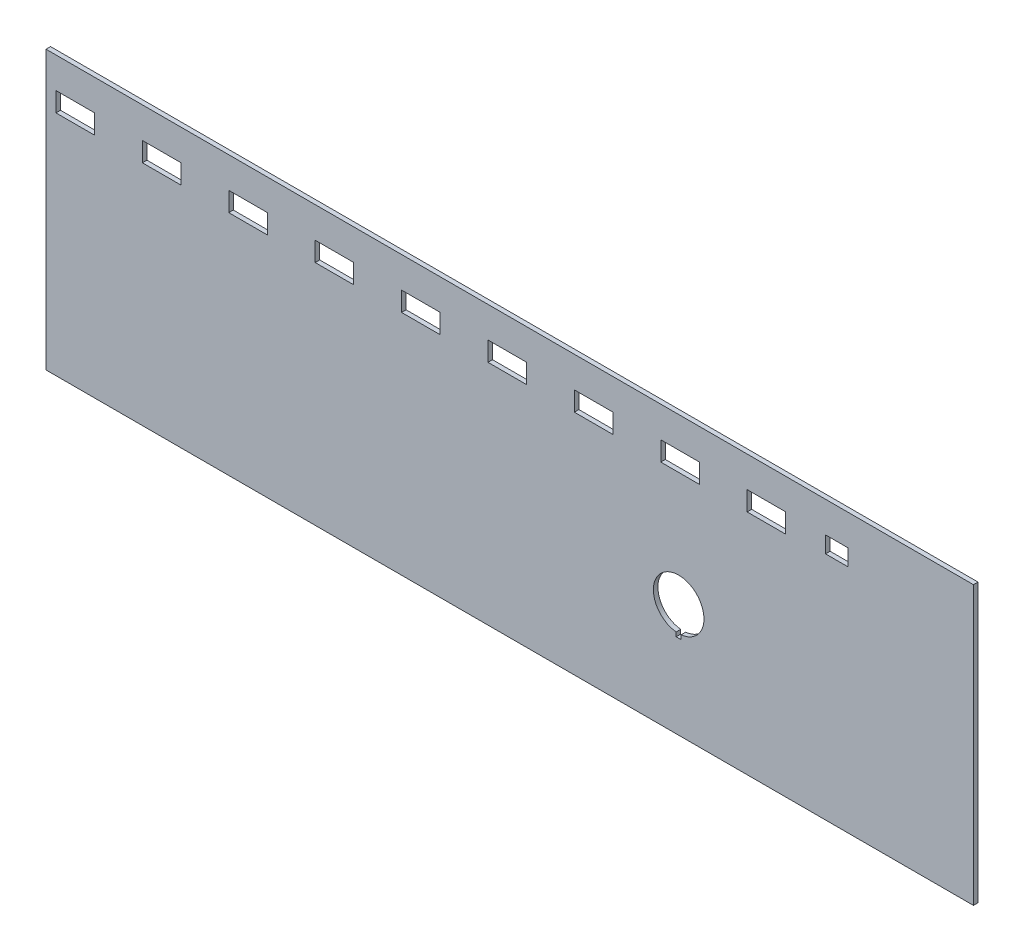
from build123d import *

# Parameters (mm, degrees)
SKETCH1_W               = 409
SKETCH1_H               = 122.5
BOSS_EXTRUDE1_DEPTH     = 2
CUT_EXTRUDE2_DEPTH      = 427.955793965
CUT_EXTRUDE2_DEPTH_BACK = 427.955793965
SKETCH2_W               = 17
SKETCH2_H               = 8.53
SKETCH2_W_2             = 10
SKETCH2_H_2             = 7.25


with BuildPart() as part:
    # Sketch1 → Boss-Extrude1 (new body)
    with BuildSketch(Plane.XY):
        with Locations((204.5, -61.25)):
            Rectangle(SKETCH1_W, SKETCH1_H)
    extrude(amount=BOSS_EXTRUDE1_DEPTH)

    # Sketch2 → Cut-Extrude2 (cut, two sides: drawn at the far end of the back side and taken through both)
    with BuildSketch(Plane.XY.offset(2).offset(-CUT_EXTRUDE2_DEPTH_BACK)):
        with Locations((12.9, -17.865)):
            Rectangle(SKETCH2_W, SKETCH2_H)
        with Locations((51, -17.865)):
            Rectangle(SKETCH2_W, SKETCH2_H)
        with Locations((89.1, -17.865)):
            Rectangle(SKETCH2_W, SKETCH2_H)
        with Locations((127.2, -17.865)):
            Rectangle(SKETCH2_W, SKETCH2_H)
        with Locations((165.3, -17.865)):
            Rectangle(SKETCH2_W, SKETCH2_H)
        with Locations((203.4, -17.865)):
            Rectangle(SKETCH2_W, SKETCH2_H)
        with Locations((279.6, -17.865)):
            Rectangle(SKETCH2_W, SKETCH2_H)
        with Locations((241.5, -17.865)):
            Rectangle(SKETCH2_W, SKETCH2_H)
        with Locations((317.7, -17.865)):
            Rectangle(SKETCH2_W, SKETCH2_H)
        with Locations((348.775, -17.225)):
            Rectangle(SKETCH2_W_2, SKETCH2_H_2)
        with BuildLine():
            Line((280.1, -85.45), (280.1, -83.595607239))
            ThreePointArc((280.1, -83.595607239), (279, -61.35), (277.9, -83.595607239))
            Line((277.9, -83.595607239), (277.9, -85.45))
            Line((277.9, -85.45), (280.1, -85.45))
        make_face()
    extrude(amount=CUT_EXTRUDE2_DEPTH + CUT_EXTRUDE2_DEPTH_BACK, mode=Mode.SUBTRACT)


solid = part.part
